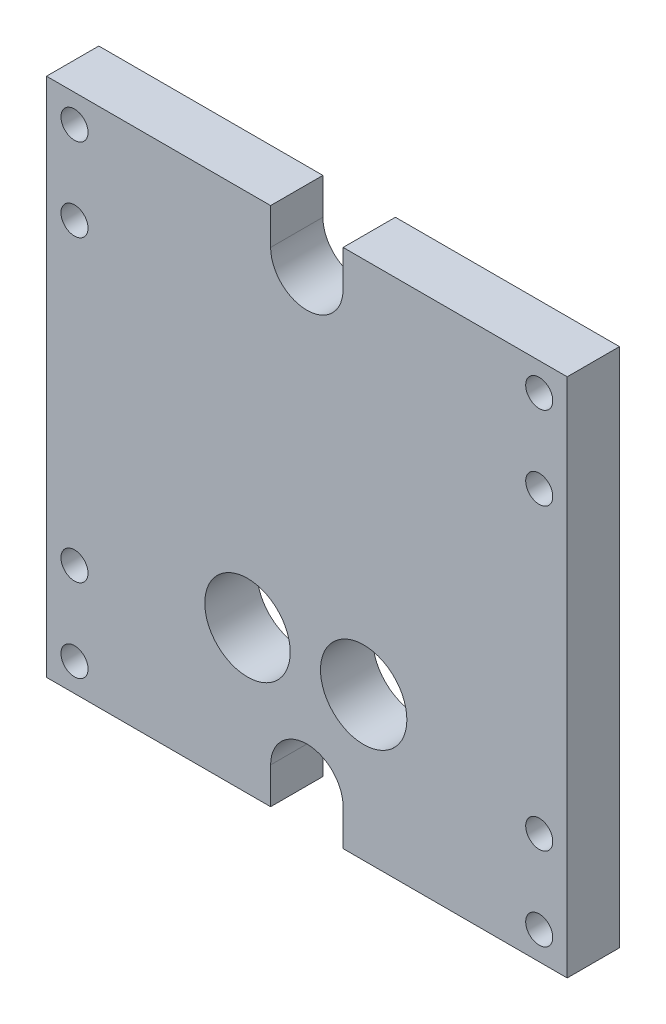
from build123d import *

# Parameters (mm, degrees)
SKETCH3_R                  = 8.172257435
SKETCH3_R_2                = 8.263232928
BOSS_EXTRUDE4_DEPTH        = 10
F_6_0_204_DIAMETER_HOLE1_D = 5.1816


with BuildPart() as part:
    # Sketch3 → Boss-Extrude4 (new body)
    # profile 1 of 5: a face of its own
    with BuildSketch(Plane.XY):
        Polygon((-49.555785737, 49.911142193), (-49.555785737, -49.688857807), (-6.690785737, -49.688857807), (-6.690785737, -42.753857807), (-6.690785737, -35.818857807), (0.244214263, -35.818857807), (7.179214263, -35.818857807), (7.179214263, -42.753857807), (7.179214263, -49.688857807), (50.044214263, -49.688857807), (50.044214263, 49.911142193), (7.179214263, 49.911142193), (7.179214263, 42.976142193), (7.179214263, 36.041142193), (0.244214299, 36.041142193), (-6.690785737, 36.041142193), (-6.690785737, 42.976142193), (-6.690785737, 49.911142193), align=None)
        with Locations((-11.1125, -22.225)):
            Circle(SKETCH3_R, mode=Mode.SUBTRACT)
        with Locations((11.1125, -22.225)):
            Circle(SKETCH3_R_2, mode=Mode.SUBTRACT)
    # profile 2 of 5: a face of its own
    with BuildSketch(Plane.XY):
        with BuildLine():
            Line((-6.690785737, -35.818857807), (-6.690785737, -42.753857807))
            ThreePointArc((-6.690785737, -42.753857807), (-4.659571264, -37.85007228), (0.244214263, -35.818857807))
            Line((0.244214263, -35.818857807), (-6.690785737, -35.818857807))
        make_face()
    # profile 3 of 5: a face of its own
    with BuildSketch(Plane.XY):
        with BuildLine():
            ThreePointArc((0.244214263, -35.818857807), (5.147999791, -37.85007228), (7.179214263, -42.753857807))
            Line((7.179214263, -42.753857807), (7.179214263, -35.818857807))
            Line((7.179214263, -35.818857807), (0.244214263, -35.818857807))
        make_face()
    # profile 4 of 5: a face of its own
    with BuildSketch(Plane.XY):
        with BuildLine():
            ThreePointArc((0.244214299, 36.041142193), (-4.659571252, 38.072356653), (-6.690785737, 42.976142193))
            Line((-6.690785737, 42.976142193), (-6.690785737, 36.041142193))
            Line((-6.690785737, 36.041142193), (0.244214299, 36.041142193))
        make_face()
    # profile 5 of 5: a face of its own
    with BuildSketch(Plane.XY):
        with BuildLine():
            Line((7.179214263, 36.041142193), (7.179214263, 42.976142193))
            ThreePointArc((7.179214263, 42.976142193), (5.147999803, 38.072356678), (0.244214299, 36.041142193))
            Line((0.244214299, 36.041142193), (7.179214263, 36.041142193))
        make_face()
    extrude(amount=BOSS_EXTRUDE4_DEPTH)

    # #6 (0.204) Diameter Hole1 (through all)
    with Locations(Plane(origin=(0, 0, 0), x_dir=(-1, 0, 0), z_dir=(0, 0, -1))):
        with Locations((44.205785737, -44.338857807), (-44.694214263, -44.338857807), (-44.694214263, 44.561142193), (44.205785737, 44.561142193), (44.205785737, 28.686142193), (44.205785737, -28.463857807), (-44.694214263, -28.463857807), (-44.694214263, 28.686142193)):
            Hole(F_6_0_204_DIAMETER_HOLE1_D / 2)


solid = part.part
